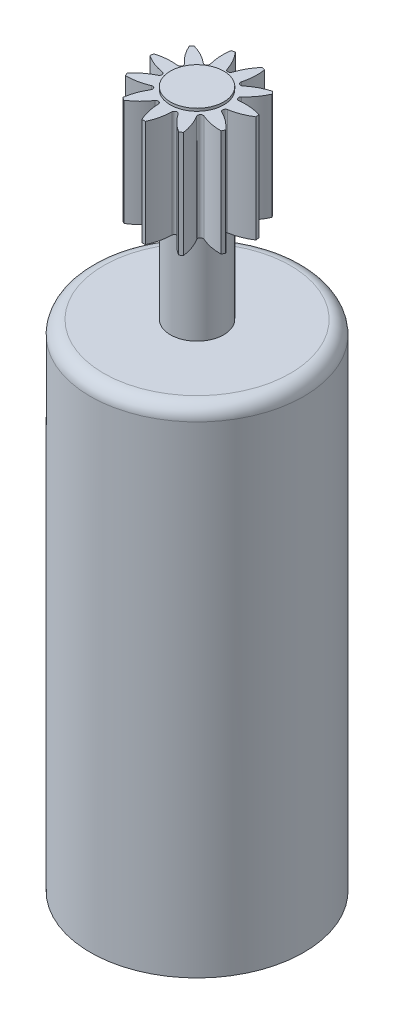
from build123d import *

# Parameters (mm, degrees)
KES_EKSTR_ZYON1_START   = -5
KES_EKSTR_ZYON1_DEPTH   = 5
DAIRESEL_KAPLAMA1_COUNT = 11
RADYUS1_R               = 0.5


with BuildPart() as part:
    # Çizim2 → Döndür1 (revolve)
    with BuildSketch(Plane.XY, mode=Mode.PRIVATE) as d_nd_r1_sk:
        Polygon((0, 0), (0, 26.1), (1, 26.1), (1, 26), (2, 26), (2, 22), (1, 22), (1, 18.541448382), (4, 18.541448382), (4, 0), align=None)
    revolve(d_nd_r1_sk.sketch.rotate(Axis((0, 0, 0), (0, 1, 0)), 90), axis=Axis((0, 0, 0), (0, 1, 0)))

    # Çizim4 → Kes-Ekstrüzyon1 (cut)
    with BuildSketch(Plane(origin=(0, 26, 0), x_dir=(1, 0, 0), z_dir=(0, 1, 0)).offset(KES_EKSTR_ZYON1_START)):
        with BuildLine():
            ThreePointArc((-0.5, 1.936491673), (0, 2), (0.5, 1.936491673))
            ThreePointArc((0.5, 1.936491673), (0.260400333, 1.599188187), (0.095331419, 1.219801979))
            ThreePointArc((0.095331419, 1.219801979), (0, 1.15), (-0.095331419, 1.219801979))
            ThreePointArc((-0.095331419, 1.219801979), (-0.260400333, 1.599188187), (-0.5, 1.936491673))
        make_face()
    kes_ekstr_zyon1 = extrude(amount=KES_EKSTR_ZYON1_DEPTH, mode=Mode.SUBTRACT)

    # Dairesel Kaplama1: Kes-Ekstrüzyon1 ×11 about axis
    dairesel_kaplama1_axis = Axis((0, 0, 0), (0, 1, 0))
    for i in range(1, DAIRESEL_KAPLAMA1_COUNT):
        add(kes_ekstr_zyon1.rotate(dairesel_kaplama1_axis, i * 360 / DAIRESEL_KAPLAMA1_COUNT), mode=Mode.SUBTRACT)

    # Radyus1
    radyus1_edges = [part.edges().sort_by_distance(p)[0] for p in [
        (0, 18.541448382, 4),
    ]]
    fillet(radyus1_edges, radius=RADYUS1_R)


solid = part.part
